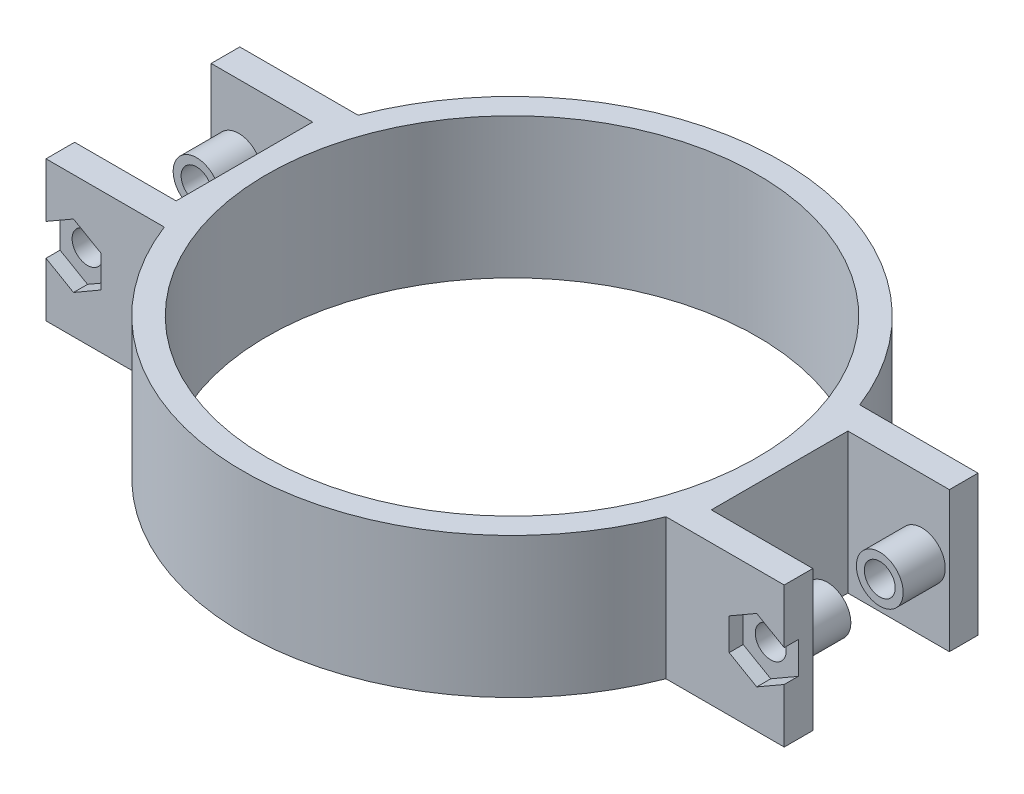
from build123d import *
from build123d.topology import SkipClean

# Parameters (mm, degrees)
SKETCH_1_R          = 26.2
EXTRUDE_1_DEPTH     = 15
SKETCH_2_R          = 1.65
CUT_EXTRUDE_1_DEPTH = 23
CUT_EXTRUDE_2_DEPTH = 1.5
CUT_EXTRUDE_3_DEPTH = 1.5
SKETCH_5_R          = 2.5
SKETCH_5_R_2        = 1.65
EXTRUDE_2_DEPTH     = 4.5
EXTRUDE_START       = 4.5
SKETCH_6_R          = 2.5
SKETCH_6_R_2        = 1.65
EXTRUDE_3_DEPTH     = 4.5
SKETCH_7_R          = 2.5
SKETCH_7_R_2        = 1.65
EXTRUDE_4_DEPTH     = 4.5
SKETCH_8_R          = 2.5
SKETCH_8_R_2        = 1.65
EXTRUDE_5_DEPTH     = 4.5


with BuildPart() as part:
    # 草图1 → 凸台-拉伸1 (new body)
    with BuildSketch(Plane(origin=(0, 0, 0), x_dir=(1, 0, 0), z_dir=(0, 1, 0))):
        with BuildLine():
            Line((-39.438756162, 7.29616989), (-28.593098218, 7.29616989))
            Line((-28.593098218, 7.29616989), (-28.593098218, -7.29616989))
            Line((-28.593098218, -7.29616989), (-39.438756162, -7.29616989))
            Line((-39.438756162, -7.29616989), (-39.438756162, -10.352673493))
            Line((-39.438756162, -10.352673493), (-26.801123198, -10.352673493))
            ThreePointArc((-26.801123198, -10.352673493), (0, -28.731133864), (26.801123198, -10.352673493))
            Line((26.801123198, -10.352673493), (39.438756162, -10.352673493))
            Line((39.438756162, -10.352673493), (39.438756162, -7.29616989))
            Line((39.438756162, -7.29616989), (28.593098218, -7.29616989))
            Line((28.593098218, -7.29616989), (28.593098218, 7.29616989))
            Line((28.593098218, 7.29616989), (39.438756162, 7.29616989))
            Line((39.438756162, 7.29616989), (39.438756162, 10.352673493))
            Line((39.438756162, 10.352673493), (26.801123198, 10.352673493))
            ThreePointArc((26.801123198, 10.352673493), (0, 28.731133864), (-26.801123198, 10.352673493))
            Line((-26.801123198, 10.352673493), (-39.438756162, 10.352673493))
            Line((-39.438756162, 10.352673493), (-39.438756162, 7.29616989))
        make_face()
        with Locations(Location((0, 0, 0), (0, 0, 270))):
            Circle(SKETCH_1_R, mode=Mode.SUBTRACT)
    extrude(amount=EXTRUDE_1_DEPTH)

    # 草图2 → 切除-拉伸1 (cut)
    with BuildSketch(Plane(origin=(0, 0, -10.352673493), x_dir=(-1, 0, 0), z_dir=(0, 0, -1))):
        with Locations((36.5, 7.5)):
            Circle(SKETCH_2_R)
        with Locations((-36.5, 7.5)):
            Circle(SKETCH_2_R)
    extrude(amount=-CUT_EXTRUDE_1_DEPTH, mode=Mode.SUBTRACT)

    # 草图3 → 切除-拉伸2 (cut)
    with BuildSketch(Plane.XY.offset(10.352673493)):
        Polygon((-36.5, 4.1), (-33.555513627, 5.8), (-33.555513627, 9.2), (-36.5, 10.9), (-39.444486373, 9.2), (-39.444486373, 5.8), align=None)
    extrude(amount=-CUT_EXTRUDE_2_DEPTH, mode=Mode.SUBTRACT)

    # 草图4 → 切除-拉伸3 (cut)
    with BuildSketch(Plane.XY.offset(10.352673493)):
        Polygon((36.5, 4.1), (39.444486373, 5.8), (39.444486373, 9.2), (36.5, 10.9), (33.555513627, 9.2), (33.555513627, 5.8), align=None)
    extrude(amount=-CUT_EXTRUDE_3_DEPTH, mode=Mode.SUBTRACT)

    # 草图5 → 凸台-拉伸2 (add)
    with SkipClean():  # the faces are left unmerged after this step: merging them gives an invalid solid
        with BuildSketch(Plane.XY.offset(-7.29616989)):
            with Locations(Location((-36.5, 7.5, 0), (0, 0, 180))):
                Circle(SKETCH_5_R)
            with Locations((-36.5, 7.5)):
                Circle(SKETCH_5_R_2, mode=Mode.SUBTRACT)
        extrude(amount=EXTRUDE_2_DEPTH)

    # 草图6 → 凸台-拉伸3 (add)
    with SkipClean():  # the faces are left unmerged after this step: merging them gives an invalid solid
        with BuildSketch(Plane(origin=(0, 0, 7.29616989), x_dir=(-1, 0, 0), z_dir=(0, 0, -1)).offset(EXTRUDE_START)):
            with Locations((36.5, 7.5)):
                Circle(SKETCH_6_R)
            with Locations((36.5, 7.5)):
                Circle(SKETCH_6_R_2, mode=Mode.SUBTRACT)
        extrude(amount=-EXTRUDE_3_DEPTH)

    # 草图7 → 凸台-拉伸4 (add)
    with SkipClean():  # the faces are left unmerged after this step: merging them gives an invalid solid
        with BuildSketch(Plane.XY.offset(-7.29616989)):
            with Locations(Location((36.5, 7.5, 0), (0, 0, 180))):
                Circle(SKETCH_7_R)
            with Locations((36.5, 7.5)):
                Circle(SKETCH_7_R_2, mode=Mode.SUBTRACT)
        extrude(amount=EXTRUDE_4_DEPTH)

    # 草图8 → 凸台-拉伸5 (add)
    with SkipClean():  # the faces are left unmerged after this step: merging them gives an invalid solid
        with BuildSketch(Plane(origin=(0, 0, 7.29616989), x_dir=(-1, 0, 0), z_dir=(0, 0, -1)).offset(EXTRUDE_START)):
            with Locations((-36.5, 7.5)):
                Circle(SKETCH_8_R)
            with Locations((-36.5, 7.5)):
                Circle(SKETCH_8_R_2, mode=Mode.SUBTRACT)
        extrude(amount=-EXTRUDE_5_DEPTH)


solid = part.part
